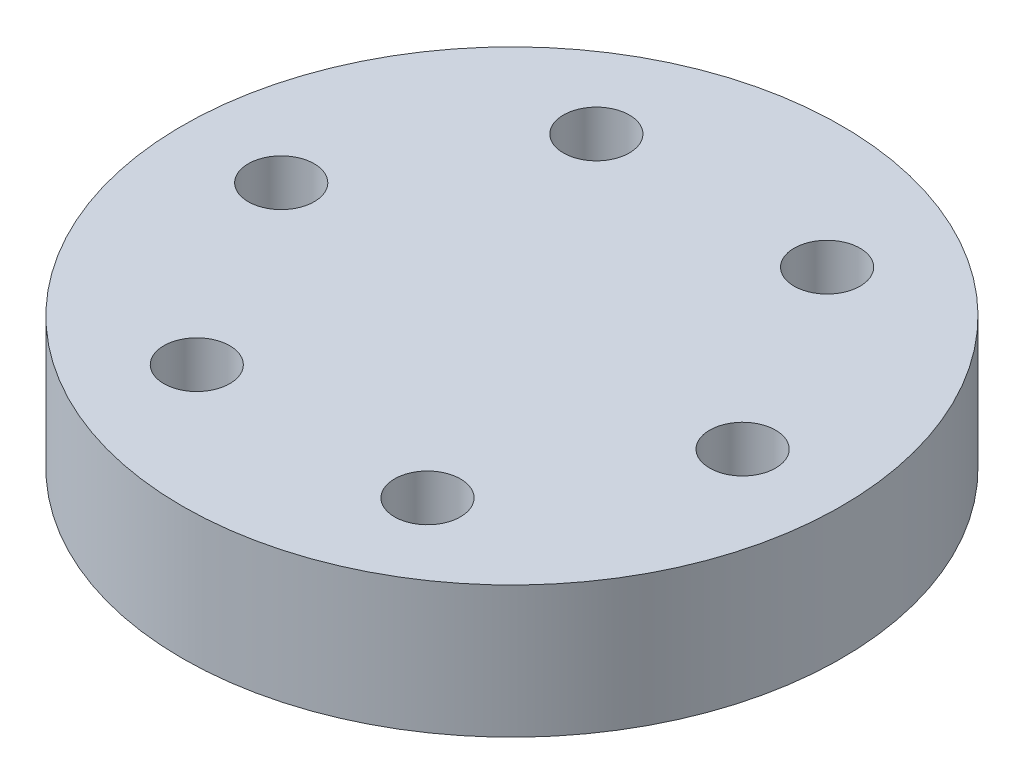
from build123d import *

# Parameters (mm, degrees)
SKETCH1_R           = 50
BOSS_EXTRUDE1_DEPTH = 20
SKETCH2_R           = 5
CUT_EXTRUDE2_DEPTH  = 10


with BuildPart() as part:
    # Sketch1 → Boss-Extrude1 (new body)
    with BuildSketch(Plane(origin=(0, 0, 0), x_dir=(1, 0, 0), z_dir=(0, 1, 0))):
        with Locations(Location((0, 0, 0), (0, 0, 270))):
            Circle(SKETCH1_R)
    extrude(amount=BOSS_EXTRUDE1_DEPTH)

    # Sketch2 → Cut-Extrude2 (cut)
    with BuildSketch(Plane(origin=(0, 20, 0), x_dir=(1, 0, 0), z_dir=(0, 1, 0))):
        with Locations(Location((-35, 0, 0), (0, 0, 270))):
            Circle(SKETCH2_R)
        with Locations(Location((-17.5, 30.310889132, 0), (0, 0, 270))):
            Circle(SKETCH2_R)
        with Locations(Location((17.5, 30.310889132, 0), (0, 0, 270))):
            Circle(SKETCH2_R)
        with Locations(Location((35, 0, 0), (0, 0, 270))):
            Circle(SKETCH2_R)
        with Locations(Location((17.5, -30.310889132, 0), (0, 0, 270))):
            Circle(SKETCH2_R)
        with Locations(Location((-17.5, -30.310889132, 0), (0, 0, 270))):
            Circle(SKETCH2_R)
    extrude(amount=-CUT_EXTRUDE2_DEPTH, mode=Mode.SUBTRACT)


solid = part.part
